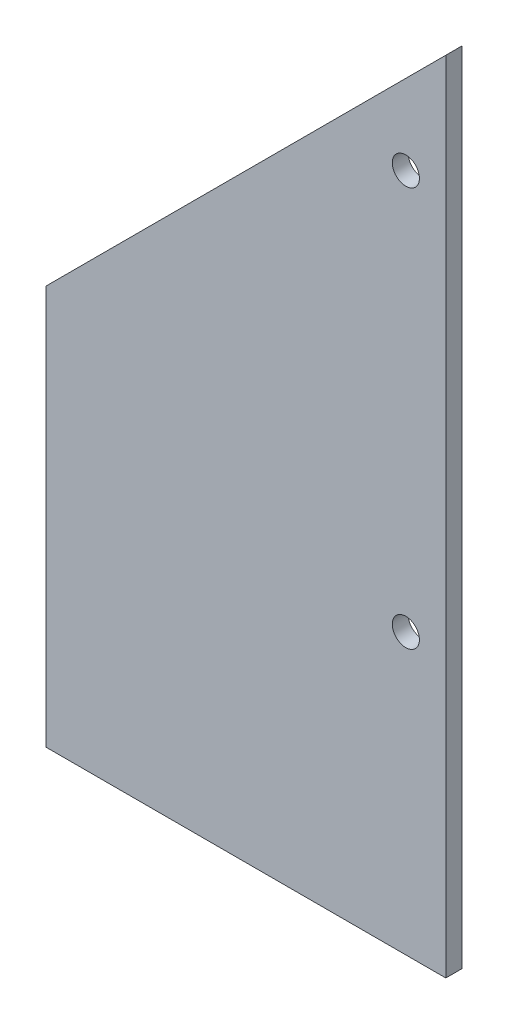
from build123d import *

# Parameters (mm, degrees)
BOSS_EXTRUDE1_DEPTH = 2
SKETCH2_R           = 1.7
CUT_EXTRUDE1_DEPTH  = 2


with BuildPart() as part:
    # Sketch1 → Boss-Extrude1 (new body)
    with BuildSketch(Plane.XY):
        Polygon((0, 0), (0, -100), (-50, -100), (-50, -50), align=None)
    extrude(amount=BOSS_EXTRUDE1_DEPTH)

    # Sketch2 → Cut-Extrude1 (cut)
    with BuildSketch(Plane.XY.offset(2)):
        with Locations((-5, -15)):
            Circle(SKETCH2_R)
        with Locations((-5, -65)):
            Circle(SKETCH2_R)
    extrude(amount=-CUT_EXTRUDE1_DEPTH, mode=Mode.SUBTRACT)


solid = part.part
